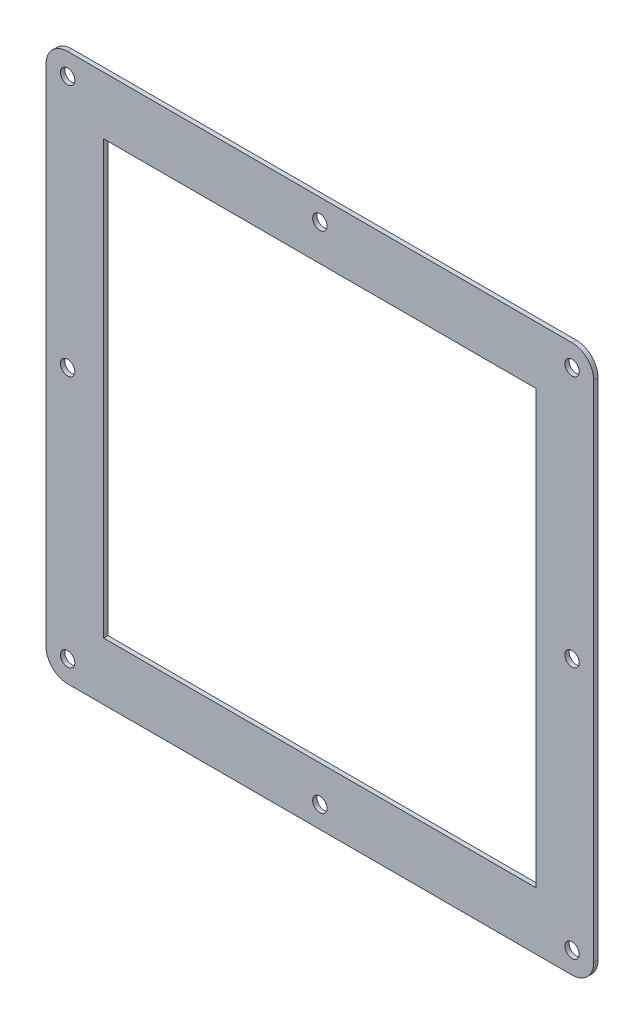
from build123d import *

# Parameters (mm, degrees)
SKETCH2_R           = 5
SKETCH2_W           = 300
SKETCH2_H           = 300
BOSS_EXTRUDE1_DEPTH = 3


with BuildPart() as part:
    # Sketch2 → Boss-Extrude1 (new body)
    with BuildSketch(Plane.XY):
        with BuildLine():
            Line((-175, 190), (175, 190))
            ThreePointArc((175, 190), (185.606601718, 185.606601718), (190, 175))
            Line((190, 175), (190, -175))
            ThreePointArc((190, -175), (185.606601718, -185.606601718), (175, -190))
            Line((175, -190), (-175, -190))
            ThreePointArc((-175, -190), (-185.606601718, -185.606601718), (-190, -175))
            Line((-190, -175), (-190, 175))
            ThreePointArc((-190, 175), (-185.606601718, 185.606601718), (-175, 190))
        make_face()
        with Locations((-175, 175)):
            Circle(SKETCH2_R, mode=Mode.SUBTRACT)
        with Locations((0, 175)):
            Circle(SKETCH2_R, mode=Mode.SUBTRACT)
        with Locations((175, 175)):
            Circle(SKETCH2_R, mode=Mode.SUBTRACT)
        with Locations((175, 0)):
            Circle(SKETCH2_R, mode=Mode.SUBTRACT)
        with Locations((-175, 0)):
            Circle(SKETCH2_R, mode=Mode.SUBTRACT)
        with Locations((-175, -175)):
            Circle(SKETCH2_R, mode=Mode.SUBTRACT)
        with Locations((0, -175)):
            Circle(SKETCH2_R, mode=Mode.SUBTRACT)
        with Locations((175, -175)):
            Circle(SKETCH2_R, mode=Mode.SUBTRACT)
        Rectangle(SKETCH2_W, SKETCH2_H, mode=Mode.SUBTRACT)
    extrude(amount=BOSS_EXTRUDE1_DEPTH)


solid = part.part
